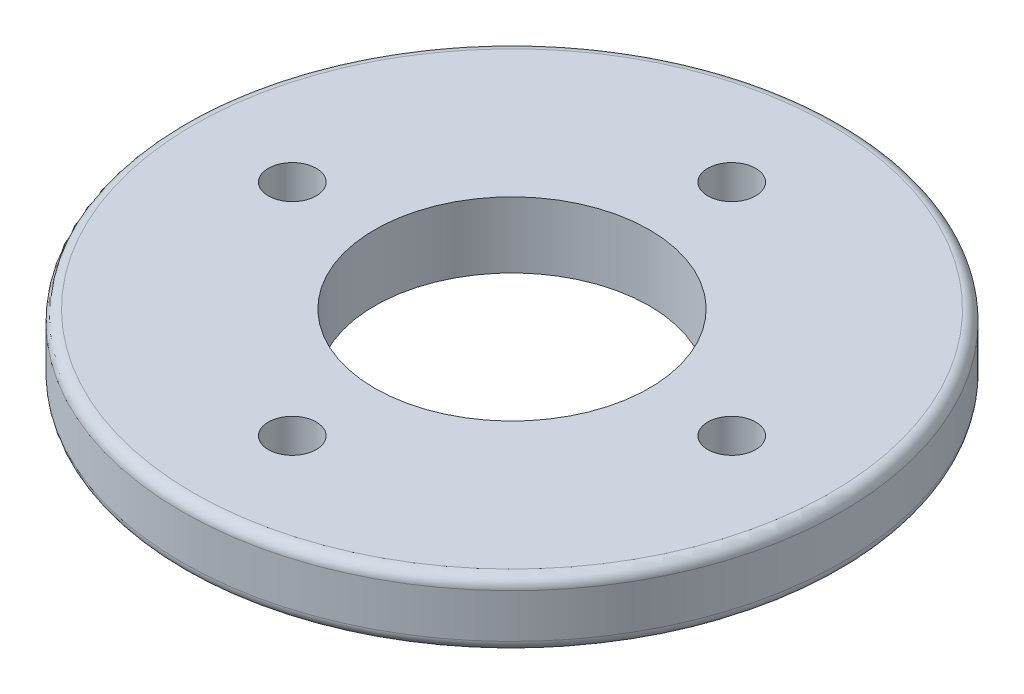
from build123d import *

# Parameters (mm, degrees)
SKETCH1_R           = 15
BOSS_EXTRUDE1_DEPTH = 3
SKETCH2_R           = 1.09
CUT_EXTRUDE1_DEPTH  = 3
CIRPATTERN1_COUNT   = 4
FILLET1_R           = 0.5
SKETCH5_R           = 6.25
CUT_EXTRUDE2_DEPTH  = 25


with BuildPart() as part:
    # Sketch1 → Boss-Extrude1 (new body)
    with BuildSketch(Plane(origin=(0, 0, 0), x_dir=(1, 0, 0), z_dir=(0, 1, 0))):
        with Locations(Location((0, 0, 0), (0, 0, 270))):
            Circle(SKETCH1_R)
    extrude(amount=BOSS_EXTRUDE1_DEPTH)

    # Sketch2 → Cut-Extrude1 (cut)
    with BuildSketch(Plane(origin=(0, 3, 0), x_dir=(1, 0, 0), z_dir=(0, 1, 0))):
        with Locations(Location((0, 10, 0), (0, 0, 270))):
            Circle(SKETCH2_R)
    cut_extrude1 = extrude(amount=-CUT_EXTRUDE1_DEPTH, mode=Mode.SUBTRACT)

    # CirPattern1: Cut-Extrude1 ×4 about axis
    cirpattern1_axis = Axis((0, 0, 0), (0, 1, 0))
    for i in range(1, CIRPATTERN1_COUNT):
        add(cut_extrude1.rotate(cirpattern1_axis, i * 360 / CIRPATTERN1_COUNT), mode=Mode.SUBTRACT)

    # Fillet1
    fillet1_edges = [part.edges().sort_by_distance(p)[0] for p in [
        (0, 0, -15),
        (0, 3, -15),
    ]]
    fillet(fillet1_edges, radius=FILLET1_R)

    # Sketch5 → Cut-Extrude2 (cut, symmetric)
    with BuildSketch(Plane(origin=(0, 3, 0), x_dir=(1, 0, 0), z_dir=(0, 1, 0))):
        with Locations(Location((0, 0, 0), (0, 0, 270))):
            Circle(SKETCH5_R)
    extrude(amount=CUT_EXTRUDE2_DEPTH, both=True, mode=Mode.SUBTRACT)


solid = part.part
